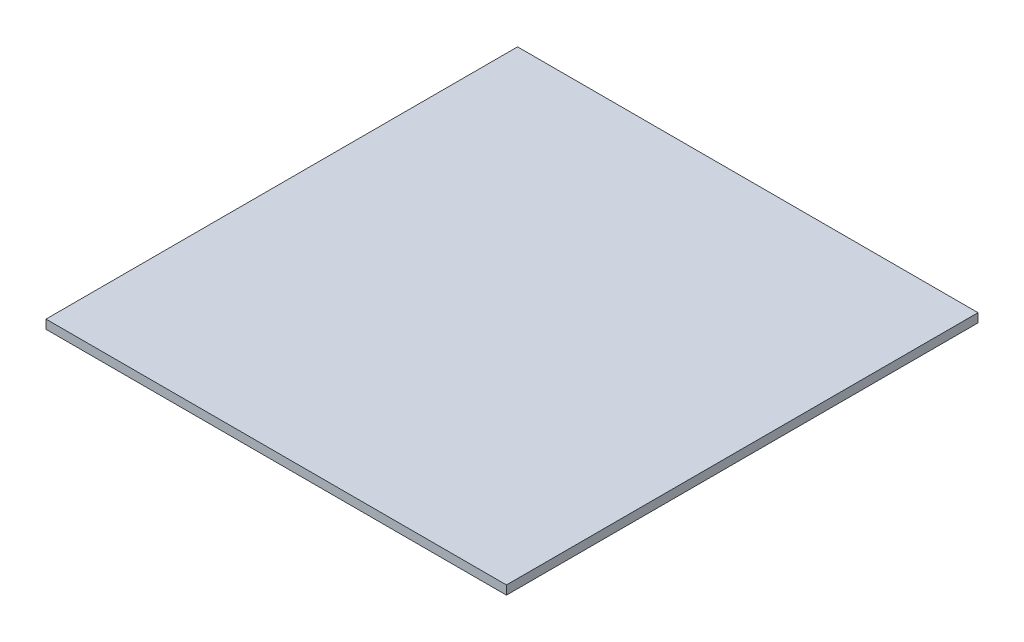
from build123d import *

# Parameters (mm, degrees)
SKETCH1_W           = 83
SKETCH1_H           = 85
BOSS_EXTRUDE1_DEPTH = 1.6


with BuildPart() as part:
    # Sketch1 → Boss-Extrude1 (new body)
    with BuildSketch(Plane(origin=(0, 0, 0), x_dir=(1, 0, 0), z_dir=(0, 1, 0))):
        Rectangle(SKETCH1_W, SKETCH1_H)
    extrude(amount=BOSS_EXTRUDE1_DEPTH)


solid = part.part
